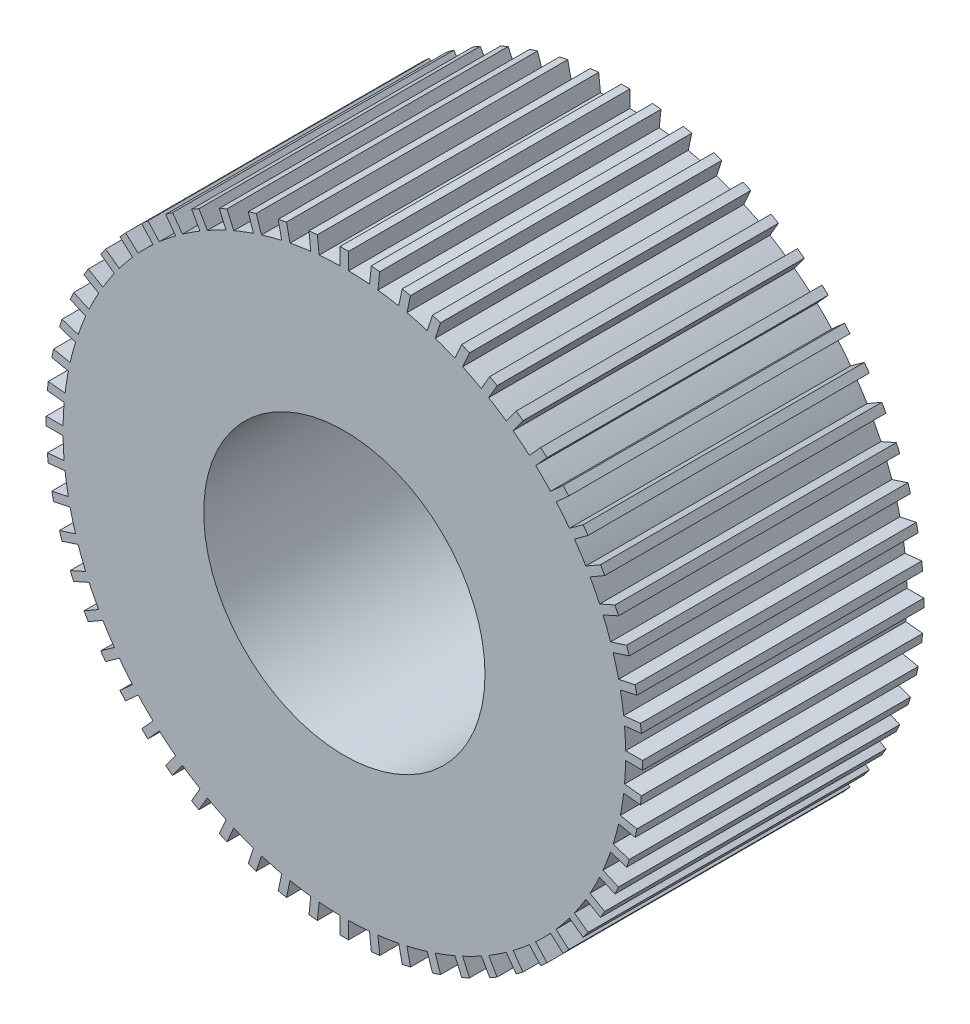
from build123d import *

# Parameters (mm, degrees)
SKETCH1_R           = 50.8
BOSS_EXTRUDE3_DEPTH = 101.6


with BuildPart() as part:
    # Sketch1 → Boss-Extrude3 (new body)
    with BuildSketch(Plane.XY):
        with BuildLine():
            ThreePointArc((9.103245672, 101.191357923), (5.317333154, 101.460760731), (1.524, 101.588569357))
            Line((1.524, 101.588569357), (1.524, 107.696))
            Line((1.524, 107.696), (-1.524, 107.696))
            Line((-1.524, 107.696), (-1.524, 101.588569357))
            ThreePointArc((-1.524, 101.588569357), (-5.317333154, 101.460760731), (-9.103245672, 101.191357923))
            Line((-9.103245672, 101.191357923), (-9.741646012, 107.265331422))
            Line((-9.741646012, 107.265331422), (-12.772948749, 106.946728666))
            Line((-12.772948749, 106.946728666), (-12.134548409, 100.872755167))
            ThreePointArc((-12.134548409, 100.872755167), (-15.893741648, 100.349135404), (-19.630754279, 99.685472795))
            Line((-19.630754279, 99.685472795), (-20.900560511, 105.659441425))
            Line((-20.900560511, 105.659441425), (-23.881954398, 105.025726592))
            Line((-23.881954398, 105.025726592), (-22.612148166, 99.051757962))
            ThreePointArc((-22.612148166, 99.051757962), (-26.296014982, 98.138063951), (-29.943184235, 97.087412767))
            Line((-29.943184235, 97.087412767), (-31.830484095, 102.895924478))
            Line((-31.830484095, 102.895924478), (-34.729304357, 101.954040679))
            Line((-34.729304357, 101.954040679), (-32.842004496, 96.145528969))
            ThreePointArc((-32.842004496, 96.145528969), (-36.410183674, 94.851771332), (-39.927550398, 93.425642729))
            Line((-39.927550398, 93.425642729), (-42.411666235, 99.00505825))
            Line((-42.411666235, 99.00505825), (-45.19615279, 97.765324962))
            Line((-45.19615279, 97.765324962), (-42.712036953, 92.18590944))
            ThreePointArc((-42.712036953, 92.18590944), (-46.125434774, 90.526262858), (-49.474461963, 88.740281797))
            Line((-49.474461963, 88.740281797), (-52.528177285, 94.029471886))
            Line((-52.528177285, 94.029471886), (-55.167822715, 92.505471886))
            Line((-55.167822715, 92.505471886), (-52.114107394, 87.216281797))
            ThreePointArc((-52.114107394, 87.216281797), (-55.335325958, 85.208929703), (-58.47932097, 83.082663769))
            Line((-58.47932097, 83.082663769), (-62.069178631, 88.023678951))
            Line((-62.069178631, 88.023678951), (-64.53506243, 86.232109502))
            Line((-64.53506243, 86.232109502), (-60.945204769, 81.29109432))
            ThreePointArc((-60.945204769, 81.29109432), (-63.938951731, 78.958029684), (-66.843468299, 76.514774689))
            Line((-66.843468299, 76.514774689), (-70.930137068, 81.053480169))
            Line((-70.930137068, 81.053480169), (-73.195242496, 79.013970081))
            Line((-73.195242496, 79.013970081), (-69.108573727, 74.475264601))
            ThreePointArc((-69.108573727, 74.475264601), (-71.842048969, 71.842048969), (-74.475264601, 69.108573727))
            Line((-74.475264601, 69.108573727), (-79.013970081, 73.195242496))
            Line((-79.013970081, 73.195242496), (-81.053480169, 70.930137068))
            Line((-81.053480169, 70.930137068), (-76.514774689, 66.843468299))
            ThreePointArc((-76.514774689, 66.843468299), (-78.958029684, 63.938951731), (-81.29109432, 60.945204769))
            Line((-81.29109432, 60.945204769), (-86.232109502, 64.53506243))
            Line((-86.232109502, 64.53506243), (-88.023678951, 62.069178631))
            Line((-88.023678951, 62.069178631), (-83.082663769, 58.47932097))
            ThreePointArc((-83.082663769, 58.47932097), (-85.208929703, 55.335325958), (-87.216281797, 52.114107394))
            Line((-87.216281797, 52.114107394), (-92.505471886, 55.167822715))
            Line((-92.505471886, 55.167822715), (-94.029471886, 52.528177285))
            Line((-94.029471886, 52.528177285), (-88.740281797, 49.474461963))
            ThreePointArc((-88.740281797, 49.474461963), (-90.526262858, 46.125434774), (-92.18590944, 42.712036953))
            Line((-92.18590944, 42.712036953), (-97.765324962, 45.19615279))
            Line((-97.765324962, 45.19615279), (-99.00505825, 42.411666235))
            Line((-99.00505825, 42.411666235), (-93.425642729, 39.927550398))
            ThreePointArc((-93.425642729, 39.927550398), (-94.851771332, 36.410183674), (-96.145528969, 32.842004496))
            Line((-96.145528969, 32.842004496), (-101.954040679, 34.729304357))
            Line((-101.954040679, 34.729304357), (-102.895924478, 31.830484095))
            Line((-102.895924478, 31.830484095), (-97.087412767, 29.943184235))
            ThreePointArc((-97.087412767, 29.943184235), (-98.138063951, 26.296014982), (-99.051757962, 22.612148166))
            Line((-99.051757962, 22.612148166), (-105.025726592, 23.881954398))
            Line((-105.025726592, 23.881954398), (-105.659441425, 20.900560511))
            Line((-105.659441425, 20.900560511), (-99.685472795, 19.630754279))
            ThreePointArc((-99.685472795, 19.630754279), (-100.349135404, 15.893741648), (-100.872755167, 12.134548409))
            Line((-100.872755167, 12.134548409), (-106.946728666, 12.772948749))
            Line((-106.946728666, 12.772948749), (-107.265331422, 9.741646012))
            Line((-107.265331422, 9.741646012), (-101.191357923, 9.103245672))
            ThreePointArc((-101.191357923, 9.103245672), (-101.460760731, 5.317333154), (-101.588569357, 1.524))
            Line((-101.588569357, 1.524), (-107.696, 1.524))
            Line((-107.696, 1.524), (-107.696, -1.524))
            Line((-107.696, -1.524), (-101.588569357, -1.524))
            ThreePointArc((-101.588569357, -1.524), (-101.460760731, -5.317333154), (-101.191357923, -9.103245672))
            Line((-101.191357923, -9.103245672), (-107.265331422, -9.741646012))
            Line((-107.265331422, -9.741646012), (-106.946728666, -12.772948749))
            Line((-106.946728666, -12.772948749), (-100.872755167, -12.134548409))
            ThreePointArc((-100.872755167, -12.134548409), (-100.349135404, -15.893741648), (-99.685472795, -19.630754279))
            Line((-99.685472795, -19.630754279), (-105.659441425, -20.900560511))
            Line((-105.659441425, -20.900560511), (-105.025726592, -23.881954398))
            Line((-105.025726592, -23.881954398), (-99.051757962, -22.612148166))
            ThreePointArc((-99.051757962, -22.612148166), (-98.138063951, -26.296014982), (-97.087412767, -29.943184235))
            Line((-97.087412767, -29.943184235), (-102.895924478, -31.830484095))
            Line((-102.895924478, -31.830484095), (-101.954040679, -34.729304357))
            Line((-101.954040679, -34.729304357), (-96.145528969, -32.842004496))
            ThreePointArc((-96.145528969, -32.842004496), (-94.851771332, -36.410183674), (-93.425642729, -39.927550398))
            Line((-93.425642729, -39.927550398), (-99.00505825, -42.411666235))
            Line((-99.00505825, -42.411666235), (-97.765324962, -45.19615279))
            Line((-97.765324962, -45.19615279), (-92.18590944, -42.712036953))
            ThreePointArc((-92.18590944, -42.712036953), (-90.526262858, -46.125434774), (-88.740281797, -49.474461963))
            Line((-88.740281797, -49.474461963), (-94.029471886, -52.528177285))
            Line((-94.029471886, -52.528177285), (-92.505471886, -55.167822715))
            Line((-92.505471886, -55.167822715), (-87.216281797, -52.114107394))
            ThreePointArc((-87.216281797, -52.114107394), (-85.208929703, -55.335325958), (-83.082663769, -58.47932097))
            Line((-83.082663769, -58.47932097), (-88.023678951, -62.069178631))
            Line((-88.023678951, -62.069178631), (-86.232109502, -64.53506243))
            Line((-86.232109502, -64.53506243), (-81.29109432, -60.945204769))
            ThreePointArc((-81.29109432, -60.945204769), (-78.958029684, -63.938951731), (-76.514774689, -66.843468299))
            Line((-76.514774689, -66.843468299), (-81.053480169, -70.930137068))
            Line((-81.053480169, -70.930137068), (-79.013970081, -73.195242496))
            Line((-79.013970081, -73.195242496), (-74.475264601, -69.108573727))
            ThreePointArc((-74.475264601, -69.108573727), (-71.842048969, -71.842048969), (-69.108573727, -74.475264601))
            Line((-69.108573727, -74.475264601), (-73.195242496, -79.013970081))
            Line((-73.195242496, -79.013970081), (-70.930137068, -81.053480169))
            Line((-70.930137068, -81.053480169), (-66.843468299, -76.514774689))
            ThreePointArc((-66.843468299, -76.514774689), (-63.938951731, -78.958029684), (-60.945204769, -81.29109432))
            Line((-60.945204769, -81.29109432), (-64.53506243, -86.232109502))
            Line((-64.53506243, -86.232109502), (-62.069178631, -88.023678951))
            Line((-62.069178631, -88.023678951), (-58.47932097, -83.082663769))
            ThreePointArc((-58.47932097, -83.082663769), (-55.335325958, -85.208929703), (-52.114107394, -87.216281797))
            Line((-52.114107394, -87.216281797), (-55.167822715, -92.505471886))
            Line((-55.167822715, -92.505471886), (-52.528177285, -94.029471886))
            Line((-52.528177285, -94.029471886), (-49.474461963, -88.740281797))
            ThreePointArc((-49.474461963, -88.740281797), (-46.125434774, -90.526262858), (-42.712036953, -92.18590944))
            Line((-42.712036953, -92.18590944), (-45.19615279, -97.765324962))
            Line((-45.19615279, -97.765324962), (-42.411666235, -99.00505825))
            Line((-42.411666235, -99.00505825), (-39.927550398, -93.425642729))
            ThreePointArc((-39.927550398, -93.425642729), (-36.410183674, -94.851771332), (-32.842004496, -96.145528969))
            Line((-32.842004496, -96.145528969), (-34.729304357, -101.954040679))
            Line((-34.729304357, -101.954040679), (-31.830484095, -102.895924478))
            Line((-31.830484095, -102.895924478), (-29.943184235, -97.087412767))
            ThreePointArc((-29.943184235, -97.087412768), (-26.296014982, -98.138063951), (-22.612148166, -99.051757962))
            Line((-22.612148166, -99.051757962), (-23.881954398, -105.025726592))
            Line((-23.881954398, -105.025726592), (-20.900560511, -105.659441425))
            Line((-20.900560511, -105.659441425), (-19.630754279, -99.685472795))
            ThreePointArc((-19.630754279, -99.685472795), (-15.893741648, -100.349135404), (-12.134548409, -100.872755167))
            Line((-12.134548409, -100.872755167), (-12.772948749, -106.946728666))
            Line((-12.772948749, -106.946728666), (-9.741646012, -107.265331422))
            Line((-9.741646012, -107.265331422), (-9.103245672, -101.191357923))
            ThreePointArc((-9.103245672, -101.191357923), (-5.317333154, -101.460760731), (-1.524, -101.588569357))
            Line((-1.524, -101.588569357), (-1.524, -107.696))
            Line((-1.524, -107.696), (1.524, -107.696))
            Line((1.524, -107.696), (1.524, -101.588569357))
            ThreePointArc((1.524, -101.588569357), (5.317333154, -101.460760731), (9.103245672, -101.191357923))
            Line((9.103245672, -101.191357923), (9.741646012, -107.265331422))
            Line((9.741646012, -107.265331422), (12.772948749, -106.946728666))
            Line((12.772948749, -106.946728666), (12.134548409, -100.872755167))
            ThreePointArc((12.134548409, -100.872755167), (15.893741648, -100.349135404), (19.630754279, -99.685472795))
            Line((19.630754279, -99.685472795), (20.900560511, -105.659441425))
            Line((20.900560511, -105.659441425), (23.881954398, -105.025726592))
            Line((23.881954398, -105.025726592), (22.612148166, -99.051757962))
            ThreePointArc((22.612148166, -99.051757962), (26.296014982, -98.138063951), (29.943184235, -97.087412767))
            Line((29.943184235, -97.087412767), (31.830484095, -102.895924478))
            Line((31.830484095, -102.895924478), (34.729304357, -101.954040679))
            Line((34.729304357, -101.954040679), (32.842004496, -96.145528969))
            ThreePointArc((32.842004496, -96.145528969), (36.410183674, -94.851771332), (39.927550398, -93.425642729))
            Line((39.927550398, -93.425642729), (42.411666235, -99.00505825))
            Line((42.411666235, -99.00505825), (45.19615279, -97.765324962))
            Line((45.19615279, -97.765324962), (42.712036953, -92.18590944))
            ThreePointArc((42.712036953, -92.18590944), (46.125434774, -90.526262858), (49.474461963, -88.740281797))
            Line((49.474461963, -88.740281797), (52.528177285, -94.029471886))
            Line((52.528177285, -94.029471886), (55.167822715, -92.505471886))
            Line((55.167822715, -92.505471886), (52.114107394, -87.216281797))
            ThreePointArc((52.114107394, -87.216281797), (55.335325958, -85.208929703), (58.47932097, -83.082663769))
            Line((58.47932097, -83.082663769), (62.069178631, -88.023678951))
            Line((62.069178631, -88.023678951), (64.53506243, -86.232109502))
            Line((64.53506243, -86.232109502), (60.945204769, -81.29109432))
            ThreePointArc((60.945204769, -81.29109432), (63.938951731, -78.958029684), (66.843468299, -76.514774689))
            Line((66.843468299, -76.514774689), (70.930137068, -81.053480169))
            Line((70.930137068, -81.053480169), (73.195242496, -79.013970081))
            Line((73.195242496, -79.013970081), (69.108573727, -74.475264601))
            ThreePointArc((69.108573727, -74.475264601), (71.842048969, -71.842048969), (74.475264601, -69.108573727))
            Line((74.475264601, -69.108573727), (79.013970081, -73.195242496))
            Line((79.013970081, -73.195242496), (81.053480169, -70.930137068))
            Line((81.053480169, -70.930137068), (76.514774689, -66.843468299))
            ThreePointArc((76.514774689, -66.843468299), (78.958029684, -63.938951731), (81.29109432, -60.945204769))
            Line((81.29109432, -60.945204769), (86.232109502, -64.53506243))
            Line((86.232109502, -64.53506243), (88.023678951, -62.069178631))
            Line((88.023678951, -62.069178631), (83.082663769, -58.47932097))
            ThreePointArc((83.082663769, -58.47932097), (85.208929703, -55.335325958), (87.216281797, -52.114107394))
            Line((87.216281797, -52.114107394), (92.505471886, -55.167822715))
            Line((92.505471886, -55.167822715), (94.029471886, -52.528177285))
            Line((94.029471886, -52.528177285), (88.740281797, -49.474461963))
            ThreePointArc((88.740281797, -49.474461963), (90.526262858, -46.125434774), (92.18590944, -42.712036953))
            Line((92.18590944, -42.712036953), (97.765324962, -45.19615279))
            Line((97.765324962, -45.19615279), (99.00505825, -42.411666235))
            Line((99.00505825, -42.411666235), (93.425642729, -39.927550398))
            ThreePointArc((93.425642729, -39.927550398), (94.851771332, -36.410183674), (96.145528969, -32.842004496))
            Line((96.145528969, -32.842004496), (101.95404068, -34.729304357))
            Line((101.95404068, -34.729304357), (102.895924478, -31.830484095))
            Line((102.895924478, -31.830484095), (97.087412768, -29.943184235))
            ThreePointArc((97.087412767, -29.943184235), (98.138063951, -26.296014982), (99.051757962, -22.612148166))
            Line((99.051757962, -22.612148166), (105.025726592, -23.881954398))
            Line((105.025726592, -23.881954398), (105.659441425, -20.900560511))
            Line((105.659441425, -20.900560511), (99.685472795, -19.630754279))
            ThreePointArc((99.685472795, -19.630754279), (100.349135404, -15.893741648), (100.872755167, -12.134548409))
            Line((100.872755167, -12.134548409), (106.946728666, -12.772948749))
            Line((106.946728666, -12.772948749), (107.265331422, -9.741646012))
            Line((107.265331422, -9.741646012), (101.191357923, -9.103245672))
            ThreePointArc((101.191357923, -9.103245672), (101.460760731, -5.317333154), (101.588569357, -1.524))
            Line((101.588569357, -1.524), (107.696, -1.524))
            Line((107.696, -1.524), (107.696, 1.524))
            Line((107.696, 1.524), (101.588569357, 1.524))
            ThreePointArc((101.588569357, 1.524), (101.460760731, 5.317333154), (101.191357923, 9.103245672))
            Line((101.191357923, 9.103245672), (107.265331422, 9.741646012))
            Line((107.265331422, 9.741646012), (106.946728666, 12.772948749))
            Line((106.946728666, 12.772948749), (100.872755167, 12.134548409))
            ThreePointArc((100.872755167, 12.134548409), (100.349135404, 15.893741648), (99.685472795, 19.630754279))
            Line((99.685472795, 19.630754279), (105.659441425, 20.900560511))
            Line((105.659441425, 20.900560511), (105.025726592, 23.881954398))
            Line((105.025726592, 23.881954398), (99.051757962, 22.612148166))
            ThreePointArc((99.051757962, 22.612148166), (98.138063951, 26.296014982), (97.087412767, 29.943184235))
            Line((97.087412768, 29.943184235), (102.895924478, 31.830484095))
            Line((102.895924478, 31.830484095), (101.95404068, 34.729304357))
            Line((101.95404068, 34.729304357), (96.145528969, 32.842004496))
            ThreePointArc((96.145528969, 32.842004496), (94.851771332, 36.410183674), (93.425642729, 39.927550398))
            Line((93.425642729, 39.927550398), (99.00505825, 42.411666235))
            Line((99.00505825, 42.411666235), (97.765324962, 45.19615279))
            Line((97.765324962, 45.19615279), (92.18590944, 42.712036953))
            ThreePointArc((92.18590944, 42.712036953), (90.526262858, 46.125434774), (88.740281797, 49.474461963))
            Line((88.740281797, 49.474461963), (94.029471886, 52.528177285))
            Line((94.029471886, 52.528177285), (92.505471886, 55.167822715))
            Line((92.505471886, 55.167822715), (87.216281797, 52.114107394))
            ThreePointArc((87.216281797, 52.114107394), (85.208929703, 55.335325958), (83.082663769, 58.47932097))
            Line((83.082663769, 58.47932097), (88.023678951, 62.069178631))
            Line((88.023678951, 62.069178631), (86.232109502, 64.53506243))
            Line((86.232109502, 64.53506243), (81.29109432, 60.945204769))
            ThreePointArc((81.29109432, 60.945204769), (78.958029684, 63.938951731), (76.514774689, 66.843468299))
            Line((76.514774689, 66.843468299), (81.053480169, 70.930137068))
            Line((81.053480169, 70.930137068), (79.013970081, 73.195242496))
            Line((79.013970081, 73.195242496), (74.475264601, 69.108573727))
            ThreePointArc((74.475264601, 69.108573727), (71.842048969, 71.842048969), (69.108573727, 74.475264601))
            Line((69.108573727, 74.475264601), (73.195242496, 79.013970081))
            Line((73.195242496, 79.013970081), (70.930137068, 81.053480169))
            Line((70.930137068, 81.053480169), (66.843468299, 76.514774689))
            ThreePointArc((66.843468299, 76.514774689), (63.938951731, 78.958029684), (60.945204769, 81.29109432))
            Line((60.945204769, 81.29109432), (64.53506243, 86.232109502))
            Line((64.53506243, 86.232109502), (62.069178631, 88.023678951))
            Line((62.069178631, 88.023678951), (58.47932097, 83.082663769))
            ThreePointArc((58.47932097, 83.082663769), (55.335325958, 85.208929703), (52.114107394, 87.216281797))
            Line((52.114107394, 87.216281797), (55.167822715, 92.505471886))
            Line((55.167822715, 92.505471886), (52.528177285, 94.029471886))
            Line((52.528177285, 94.029471886), (49.474461963, 88.740281797))
            ThreePointArc((49.474461963, 88.740281797), (46.125434774, 90.526262858), (42.712036953, 92.18590944))
            Line((42.712036953, 92.18590944), (45.19615279, 97.765324962))
            Line((45.19615279, 97.765324962), (42.411666235, 99.00505825))
            Line((42.411666235, 99.00505825), (39.927550398, 93.425642729))
            ThreePointArc((39.927550398, 93.425642729), (36.410183674, 94.851771332), (32.842004496, 96.145528969))
            Line((32.842004496, 96.145528969), (34.729304357, 101.954040679))
            Line((34.729304357, 101.954040679), (31.830484095, 102.895924478))
            Line((31.830484095, 102.895924478), (29.943184235, 97.087412767))
            ThreePointArc((29.943184235, 97.087412767), (26.296014982, 98.138063951), (22.612148166, 99.051757962))
            Line((22.612148166, 99.051757962), (23.881954398, 105.025726592))
            Line((23.881954398, 105.025726592), (20.900560511, 105.659441425))
            Line((20.900560511, 105.659441425), (19.630754279, 99.685472795))
            ThreePointArc((19.630754279, 99.685472795), (15.893741648, 100.349135404), (12.134548409, 100.872755167))
            Line((12.134548409, 100.872755167), (12.772948749, 106.946728666))
            Line((12.772948749, 106.946728666), (9.741646012, 107.265331422))
            Line((9.741646012, 107.265331422), (9.103245672, 101.191357923))
        make_face()
        Circle(SKETCH1_R, mode=Mode.SUBTRACT)
    extrude(amount=BOSS_EXTRUDE3_DEPTH)


solid = part.part
